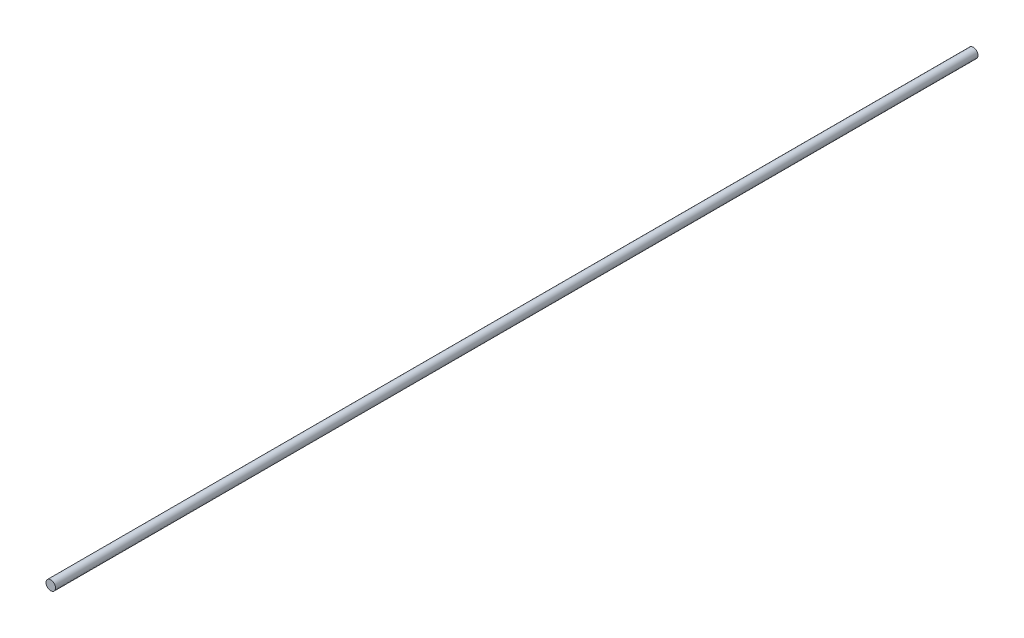
from build123d import *

# Parameters (mm, degrees)
SKETCH1_R           = 10
BOSS_EXTRUDE1_DEPTH = 1940


with BuildPart() as part:
    # Sketch1 → Boss-Extrude1 (new body)
    with BuildSketch(Plane.XY):
        Circle(SKETCH1_R)
    extrude(amount=BOSS_EXTRUDE1_DEPTH)


solid = part.part
